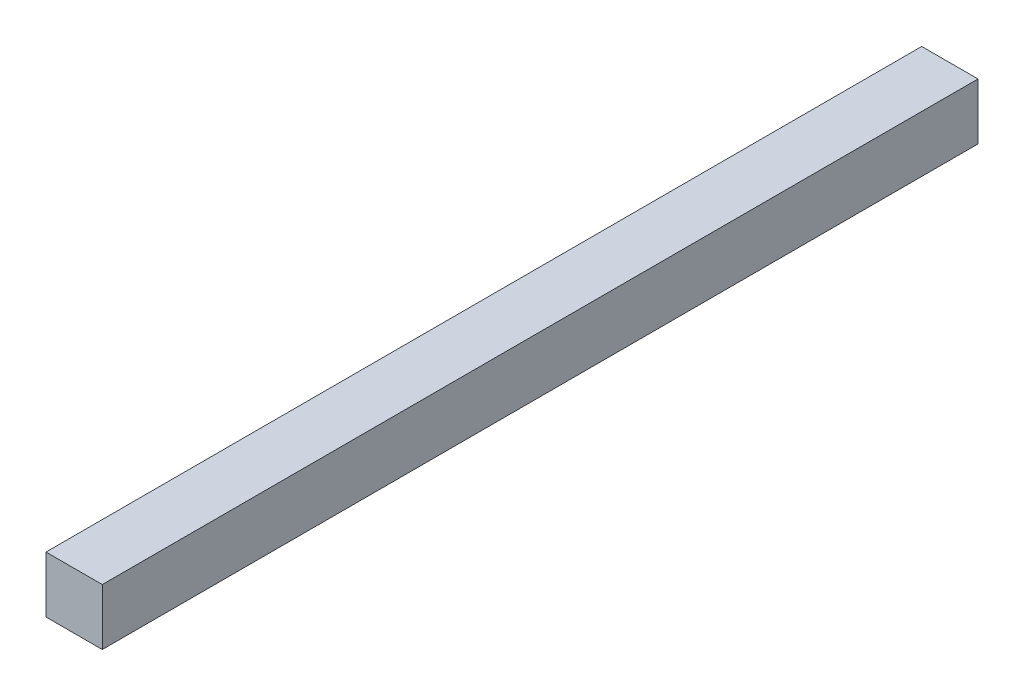
from build123d import *

# Parameters (mm, degrees)
SKETCH1_W           = 7.071067812
SKETCH1_H           = 7.071067812
BOSS_EXTRUDE1_DEPTH = 110


with BuildPart() as part:
    # Sketch1 → Boss-Extrude1 (new body)
    with BuildSketch(Plane.XY):
        Rectangle(SKETCH1_W, SKETCH1_H)
    extrude(amount=BOSS_EXTRUDE1_DEPTH)


solid = part.part
